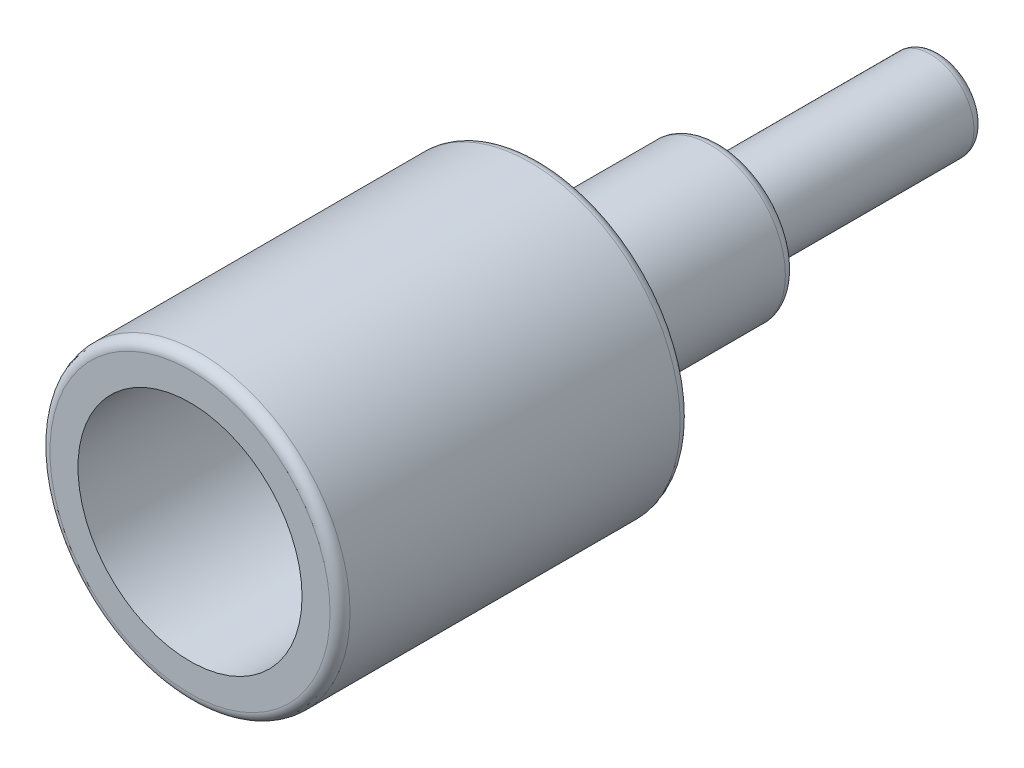
from build123d import *

# Parameters (mm, degrees)
SKETCH1_R           = 1.5
BOSS_EXTRUDE1_DEPTH = 3.5
SKETCH2_R           = 1.12
CUT_EXTRUDE1_DEPTH  = 3
SKETCH3_R           = 0.7515
BOSS_EXTRUDE2_DEPTH = 1.8
SKETCH4_R           = 0.4365
BOSS_EXTRUDE3_DEPTH = 2.2
FILLET1_R           = 0.1


with BuildPart() as part:
    # Sketch1 → Boss-Extrude1 (new body)
    with BuildSketch(Plane.XY):
        Circle(SKETCH1_R)
    extrude(amount=BOSS_EXTRUDE1_DEPTH)

    # Sketch2 → Cut-Extrude1 (cut)
    with BuildSketch(Plane.XY.offset(3.5)):
        Circle(SKETCH2_R)
    extrude(amount=-CUT_EXTRUDE1_DEPTH, mode=Mode.SUBTRACT)

    # Sketch3 → Boss-Extrude2 (add)
    with BuildSketch(Plane(origin=(0, 0, 0), x_dir=(-1, 0, 0), z_dir=(0, 0, -1))):
        Circle(SKETCH3_R)
    extrude(amount=BOSS_EXTRUDE2_DEPTH)

    # Sketch4 → Boss-Extrude3 (add)
    with BuildSketch(Plane(origin=(0, 0, -1.8), x_dir=(-1, 0, 0), z_dir=(0, 0, -1))):
        Circle(SKETCH4_R)
    extrude(amount=BOSS_EXTRUDE3_DEPTH)

    # Fillet1
    fillet1_edges = [part.edges().sort_by_distance(p)[0] for p in [
        (0.7515, 0, -1.8),
        (0.4365, 0, -1.8),
        (0.4365, 0, -4),
        (-1.5, 0, 0),
        (-1.5, 0, 3.5),
        (0.7515, 0, 0),
    ]]
    fillet(fillet1_edges, radius=FILLET1_R)


solid = part.part
